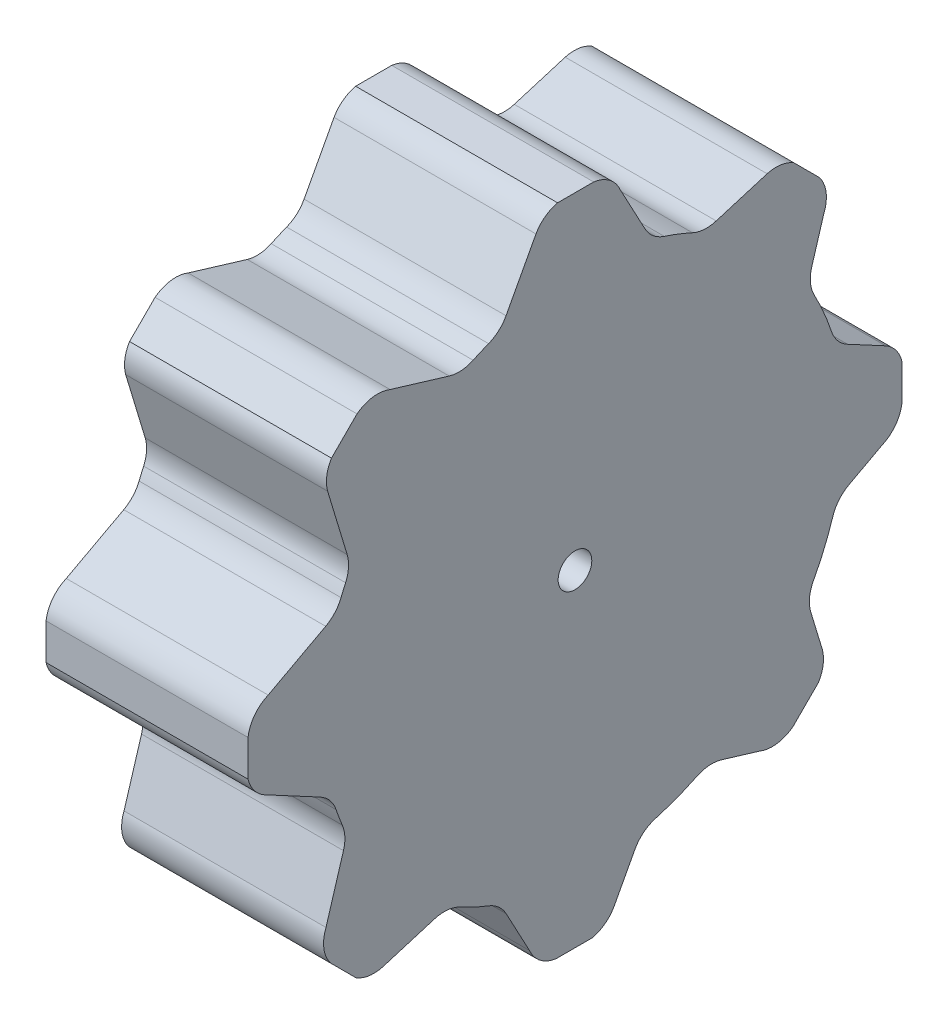
from build123d import *

# Parameters (mm, degrees)
SKETCH2_R           = 2.5
BOSS_EXTRUDE2_DEPTH = 30


with BuildPart() as part:
    # Sketch2 → Boss-Extrude2 (new body)
    with BuildSketch(Plane(origin=(0, 0, 0), x_dir=(0, 0, -1), z_dir=(1, 0, 0))):
        with BuildLine():
            Line((30.085747665, -11.186099671), (21.541651222, -15.763294195))
            ThreePointArc((21.541651222, -15.763294195), (19.517636628, -17.343724655), (18.545040528, -19.720371945))
            Line((18.545040528, -19.720371945), (18.545040528, -25.085535704))
            ThreePointArc((18.545040528, -25.085535704), (19.410646287, -26.94173637), (20.947854528, -28.295156137))
            Line((20.947854528, -28.295156137), (29.255531223, -32.745697224))
            ThreePointArc((29.255531223, -32.745697224), (30.70940007, -33.921076219), (31.629897073, -35.548324102))
            ThreePointArc((31.629897073, -35.548324102), (32.071931866, -36.783630966), (32.555458455, -38.00329479))
            ThreePointArc((32.555458455, -38.00329479), (32.932855534, -39.672508554), (32.725254973, -41.37121546))
            Line((32.725254973, -41.37121546), (30.127327196, -49.964361184))
            ThreePointArc((30.127327196, -49.964361184), (29.813665847, -52.513088724), (30.806479965, -54.881361437))
            Line((30.806479965, -54.881361437), (34.600223641, -58.675105113))
            ThreePointArc((34.600223641, -58.675105113), (36.524831421, -59.37556149), (38.568814087, -59.245603413))
            Line((38.568814087, -59.245603413), (46.247135524, -56.924250421))
            ThreePointArc((46.247135524, -56.924250421), (48.189416877, -56.734903616), (50.056242855, -57.303471848))
            ThreePointArc((50.056242855, -57.303471848), (52.14714523, -58.344514128), (54.296872356, -59.257922611))
            ThreePointArc((54.296872356, -59.257922611), (55.797855342, -60.175122269), (56.888305405, -61.555384489))
            Line((56.888305405, -61.555384489), (60.38212329, -68.077177874))
            ThreePointArc((60.38212329, -68.077177874), (61.96255375, -70.101192468), (64.339201041, -71.073788567))
            Line((64.339201041, -71.073788567), (69.7043648, -71.073788567))
            ThreePointArc((69.7043648, -71.073788567), (71.560565466, -70.208182809), (72.913985233, -68.670974568))
            Line((72.913985233, -68.670974568), (76.025985896, -62.861906663))
            ThreePointArc((76.025985896, -62.861906663), (77.294737312, -61.33085674), (79.059877782, -60.415366082))
            ThreePointArc((79.059877782, -60.415366082), (82.213367183, -59.366491991), (85.265589491, -58.05174059))
            ThreePointArc((85.265589491, -58.05174059), (87.048884387, -57.57014809), (88.885340547, -57.768896167))
            Line((88.885340547, -57.768896167), (94.58319028, -59.4915019))
            ThreePointArc((94.58319028, -59.4915019), (97.13191782, -59.805163248), (99.500190533, -58.812349131))
            Line((99.500190533, -58.812349131), (103.293934209, -55.018605455))
            ThreePointArc((103.293934209, -55.018605455), (103.994390585, -53.093997675), (103.864432509, -51.050015008))
            Line((103.864432509, -51.050015008), (102.151862248, -45.385359528))
            ThreePointArc((102.151862248, -45.385359528), (101.963471996, -43.433562355), (102.540152369, -41.559411123))
            ThreePointArc((102.540152369, -41.559411123), (104.144447245, -38.22268307), (105.423574244, -34.748298193))
            ThreePointArc((105.423574244, -34.748298193), (106.342936692, -33.05955411), (107.831618895, -31.842627988))
            Line((107.831618895, -31.842627988), (112.696006969, -29.236705805))
            ThreePointArc((112.696006969, -29.236705805), (114.720021563, -27.656275345), (115.692617663, -25.279628055))
            Line((115.692617663, -25.279628055), (115.692617663, -19.914464296))
            ThreePointArc((115.692617663, -19.914464296), (114.827011904, -18.05826363), (113.289803663, -16.704843863))
            Line((113.289803663, -16.704843863), (107.614484835, -13.664494491))
            ThreePointArc((107.614484835, -13.664494491), (106.151590865, -12.478432267), (105.231215931, -10.835352127))
            ThreePointArc((105.231215931, -10.835352127), (104.073253902, -7.788047033), (102.663702949, -4.848640544))
            ThreePointArc((102.663702949, -4.848640544), (102.101264993, -2.987400021), (102.291326141, -1.05234718))
            Line((102.291326141, -1.05234718), (104.110330995, 4.964361184))
            ThreePointArc((104.110330995, 4.964361184), (104.423992344, 7.513088724), (103.431178226, 9.881361437))
            Line((103.431178226, 9.881361437), (99.63743455, 13.675105113))
            ThreePointArc((99.63743455, 13.675105113), (97.71282677, 14.375561489), (95.668844104, 14.245603413))
            Line((95.668844104, 14.245603413), (88.104104481, 11.958589109))
            ThreePointArc((88.104104481, 11.958589109), (86.316773657, 11.75624578), (84.573495165, 12.199500102))
            ThreePointArc((84.573495165, 12.199500102), (82.504544688, 13.07643575), (80.388319531, 13.832189213))
            ThreePointArc((80.388319531, 13.832189213), (78.725157037, 14.752239447), (77.525530925, 16.22651863))
            Line((77.525530925, 16.22651863), (73.855534901, 23.077177874))
            ThreePointArc((73.855534901, 23.077177874), (72.275104441, 25.101192468), (69.89845715, 26.073788567))
            Line((69.89845715, 26.073788567), (64.533293391, 26.073788567))
            ThreePointArc((64.533293391, 26.073788567), (62.677092726, 25.208182809), (61.323672958, 23.670974568))
            Line((61.323672958, 23.670974568), (56.878792468, 15.373864318))
            ThreePointArc((56.878792468, 15.373864318), (55.788778276, 13.99398857), (54.288444878, 13.076825711))
            ThreePointArc((54.288444878, 13.076825711), (53.130789266, 12.603622826), (51.988977307, 12.093374908))
            ThreePointArc((51.988977307, 12.093374908), (50.232381905, 11.637586716), (48.428806148, 11.838794991))
            Line((48.428806148, 11.838794991), (39.654467911, 14.4915019))
            ThreePointArc((39.654467911, 14.4915019), (37.105740371, 14.805163248), (34.737467658, 13.812349131))
            Line((34.737467658, 13.812349131), (30.943723982, 10.018605455))
            ThreePointArc((30.943723982, 10.018605455), (30.243267606, 8.093997675), (30.373225682, 6.050015008))
            Line((30.373225682, 6.050015008), (33.27387934, -3.544454783))
            ThreePointArc((33.27387934, -3.544454783), (33.476910751, -5.321546901), (33.041482883, -7.056390042))
            ThreePointArc((33.041482883, -7.056390042), (32.694654044, -7.844321785), (32.365382945, -8.639750737))
            ThreePointArc((32.365382945, -8.639750737), (31.449885158, -10.113748997), (30.085747665, -11.186099671))
        make_face()
        with Locations((67.118829096, -22.5)):
            Circle(SKETCH2_R, mode=Mode.SUBTRACT)
    extrude(amount=BOSS_EXTRUDE2_DEPTH)


solid = part.part
